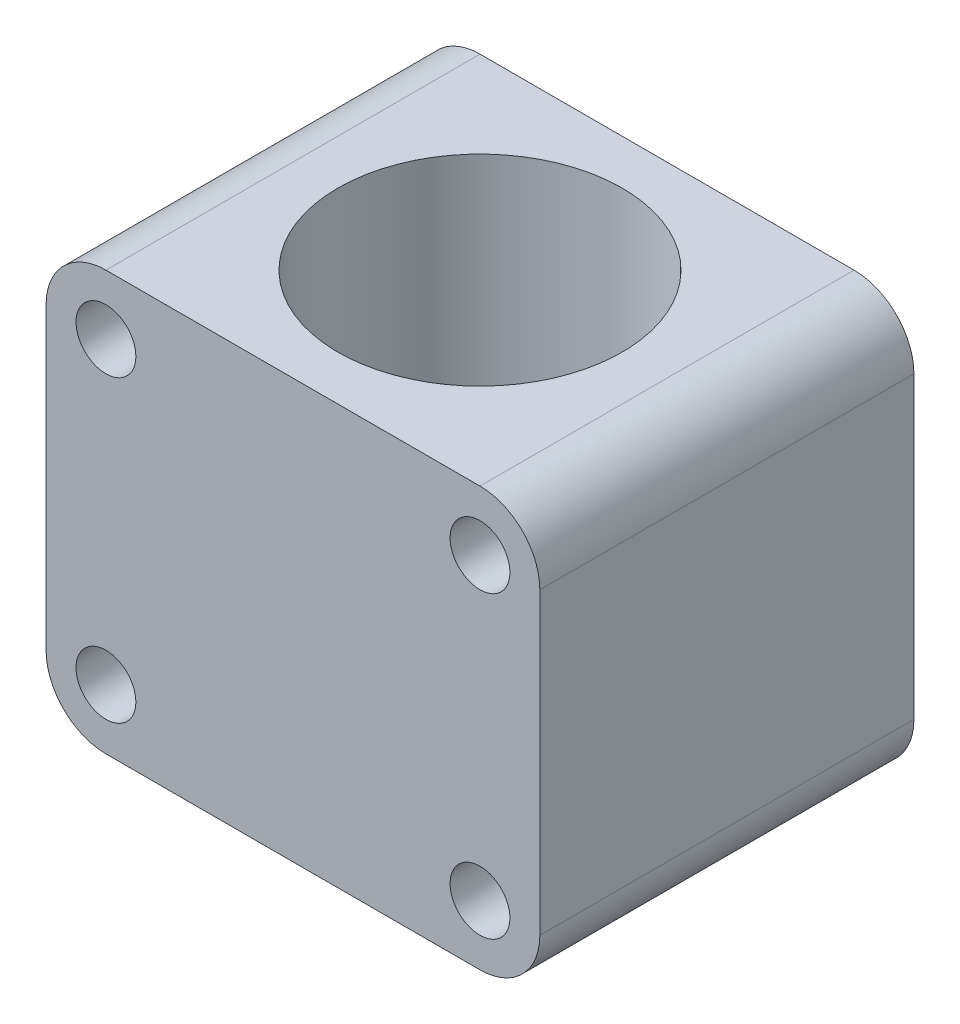
from build123d import *

# Parameters (mm, degrees)
SKETCH_1_W          = 33
SKETCH_1_H          = 28
SKETCH_1_R          = 2
EXTRUDE_1_DEPTH     = 25
FILLET_1_R          = 4
SKETCH_2_R          = 9.5
CUT_EXTRUDE_1_DEPTH = 42.003048667


with BuildPart() as part:
    # 草图1 → 凸台-拉伸1 (new body)
    with BuildSketch(Plane.XY):
        Rectangle(SKETCH_1_W, SKETCH_1_H)
        with Locations((12.5, -10)):
            Circle(SKETCH_1_R, mode=Mode.SUBTRACT)
        with Locations((-12.5, -10)):
            Circle(SKETCH_1_R, mode=Mode.SUBTRACT)
        with Locations((-12.5, 10)):
            Circle(SKETCH_1_R, mode=Mode.SUBTRACT)
        with Locations((12.5, 10)):
            Circle(SKETCH_1_R, mode=Mode.SUBTRACT)
    extrude(amount=EXTRUDE_1_DEPTH)

    # 圆角1
    fillet_1_edges = [part.edges().sort_by_distance(p)[0] for p in [
        (16.5, -14, 12.5),
        (-16.5, -14, 12.5),
        (-16.5, 14, 12.5),
        (16.5, 14, 12.5),
    ]]
    fillet(fillet_1_edges, radius=FILLET_1_R)

    # 草图2 → 切除-拉伸1 (cut, through all)
    with BuildSketch(Plane(origin=(0, 14, 0), x_dir=(1, 0, 0), z_dir=(0, 1, 0))):
        with Locations(Location((0, -12.5, 0), (0, 0, 180))):
            Circle(SKETCH_2_R)
    extrude(amount=-CUT_EXTRUDE_1_DEPTH, mode=Mode.SUBTRACT)


solid = part.part
